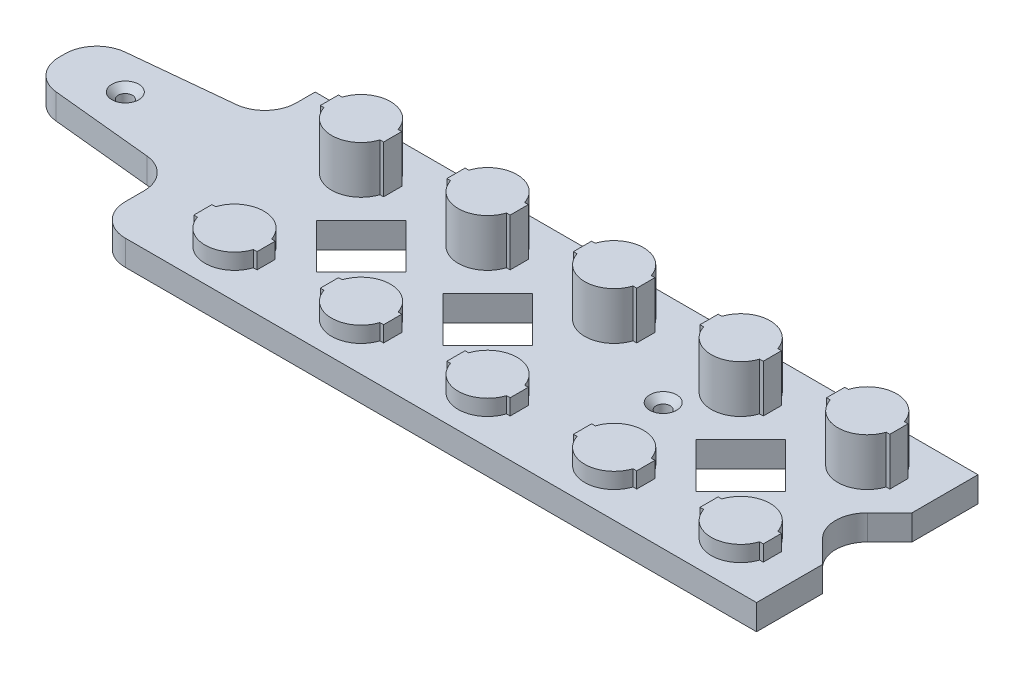
from build123d import *

# Parameters (mm, degrees)
SKETCH1_W           = 259.5
SKETCH1_H           = 70
SKETCH1_R           = 2.25
BOSS_EXTRUDE1_DEPTH = 8
BOSS_EXTRUDE2_DEPTH = 5
BOSS_EXTRUDE3_DEPTH = 15
CHAMFER2_SIZE       = 2
CUT_EXTRUDE2_DEPTH  = 194.184497308
FILLET1_R           = 10


with BuildPart() as part:
    # Sketch1 → Boss-Extrude1 (new body)
    with BuildSketch(Plane(origin=(0, 0, 0), x_dir=(1, 0, 0), z_dir=(0, 1, 0))):
        with Locations((24.75, 80)):
            Rectangle(SKETCH1_W, SKETCH1_H)
        with Locations(Location((-85, 85, 0), (0, 0, 270))):
            Circle(SKETCH1_R, mode=Mode.SUBTRACT)
        with Locations(Location((85, 85, 0), (0, 0, 270))):
            Circle(SKETCH1_R, mode=Mode.SUBTRACT)
    extrude(amount=BOSS_EXTRUDE1_DEPTH)

    # Sketch3 → Boss-Extrude2 (add)
    with BuildSketch(Plane(origin=(0, 8, 0), x_dir=(1, 0, 0), z_dir=(0, 1, 0))):
        with BuildLine():
            Line((-15.5, 57.125), (-15.5, 62.875))
            Line((-15.5, 62.875), (-16.655545523, 62.875))
            ThreePointArc((-16.655545523, 62.875), (-25.5, 69.3), (-34.344454477, 62.875))
            Line((-34.344454477, 62.875), (-35.5, 62.875))
            Line((-35.5, 62.875), (-35.5, 57.125))
            Line((-35.5, 57.125), (-34.344454477, 57.125))
            ThreePointArc((-34.344454477, 57.125), (-25.5, 50.7), (-16.655545523, 57.125))
            Line((-16.655545523, 57.125), (-15.5, 57.125))
        make_face()
        with BuildLine():
            Line((24.5, 57.125), (24.5, 62.875))
            Line((24.5, 62.875), (23.344454477, 62.875))
            ThreePointArc((23.344454477, 62.875), (14.5, 69.3), (5.655545523, 62.875))
            Line((5.655545523, 62.875), (4.5, 62.875))
            Line((4.5, 62.875), (4.5, 57.125))
            Line((4.5, 57.125), (5.655545523, 57.125))
            ThreePointArc((5.655545523, 57.125), (14.5, 50.7), (23.344454477, 57.125))
            Line((23.344454477, 57.125), (24.5, 57.125))
        make_face()
        with BuildLine():
            Line((64.5, 57.125), (64.5, 62.875))
            Line((64.5, 62.875), (63.344454477, 62.875))
            ThreePointArc((63.344454477, 62.875), (54.5, 69.3), (45.655545523, 62.875))
            Line((45.655545523, 62.875), (44.5, 62.875))
            Line((44.5, 62.875), (44.5, 57.125))
            Line((44.5, 57.125), (45.655545523, 57.125))
            ThreePointArc((45.655545523, 57.125), (54.5, 50.7), (63.344454477, 57.125))
            Line((63.344454477, 57.125), (64.5, 57.125))
        make_face()
        with BuildLine():
            Line((104.5, 57.125), (104.5, 62.875))
            Line((104.5, 62.875), (103.344454477, 62.875))
            ThreePointArc((103.344454477, 62.875), (94.5, 69.3), (85.655545523, 62.875))
            Line((85.655545523, 62.875), (84.5, 62.875))
            Line((84.5, 62.875), (84.5, 57.125))
            Line((84.5, 57.125), (85.655545523, 57.125))
            ThreePointArc((85.655545523, 57.125), (94.5, 50.7), (103.344454477, 57.125))
            Line((103.344454477, 57.125), (104.5, 57.125))
        make_face()
        with BuildLine():
            Line((144.5, 57.125), (144.5, 62.875))
            Line((144.5, 62.875), (143.344454477, 62.875))
            ThreePointArc((143.344454477, 62.875), (134.5, 69.3), (125.655545523, 62.875))
            Line((125.655545523, 62.875), (124.5, 62.875))
            Line((124.5, 62.875), (124.5, 57.125))
            Line((124.5, 57.125), (125.655545523, 57.125))
            ThreePointArc((125.655545523, 57.125), (134.5, 50.7), (143.344454477, 57.125))
            Line((143.344454477, 57.125), (144.5, 57.125))
        make_face()
    extrude(amount=BOSS_EXTRUDE2_DEPTH)

    # Sketch3<3> → Boss-Extrude3 (add)
    with BuildSketch(Plane(origin=(0, 8, 0), x_dir=(1, 0, 0), z_dir=(0, 1, 0))):
        with BuildLine():
            Line((24.5, 97.125), (24.5, 102.875))
            Line((24.5, 102.875), (23.344454477, 102.875))
            ThreePointArc((23.344454477, 102.875), (14.5, 109.3), (5.655545523, 102.875))
            Line((5.655545523, 102.875), (4.5, 102.875))
            Line((4.5, 102.875), (4.5, 97.125))
            Line((4.5, 97.125), (5.655545523, 97.125))
            ThreePointArc((5.655545523, 97.125), (14.5, 90.7), (23.344454477, 97.125))
            Line((23.344454477, 97.125), (24.5, 97.125))
        make_face()
        with BuildLine():
            Line((64.5, 97.125), (64.5, 102.875))
            Line((64.5, 102.875), (63.344454477, 102.875))
            ThreePointArc((63.344454477, 102.875), (54.5, 109.3), (45.655545523, 102.875))
            Line((45.655545523, 102.875), (44.5, 102.875))
            Line((44.5, 102.875), (44.5, 97.125))
            Line((44.5, 97.125), (45.655545523, 97.125))
            ThreePointArc((45.655545523, 97.125), (54.5, 90.7), (63.344454477, 97.125))
            Line((63.344454477, 97.125), (64.5, 97.125))
        make_face()
        with BuildLine():
            Line((104.5, 97.125), (104.5, 102.875))
            Line((104.5, 102.875), (103.344454477, 102.875))
            ThreePointArc((103.344454477, 102.875), (94.5, 109.3), (85.655545523, 102.875))
            Line((85.655545523, 102.875), (84.5, 102.875))
            Line((84.5, 102.875), (84.5, 97.125))
            Line((84.5, 97.125), (85.655545523, 97.125))
            ThreePointArc((85.655545523, 97.125), (94.5, 90.7), (103.344454477, 97.125))
            Line((103.344454477, 97.125), (104.5, 97.125))
        make_face()
        with BuildLine():
            Line((144.5, 97.125), (144.5, 102.875))
            Line((144.5, 102.875), (143.344454477, 102.875))
            ThreePointArc((143.344454477, 102.875), (134.5, 109.3), (125.655545523, 102.875))
            Line((125.655545523, 102.875), (124.5, 102.875))
            Line((124.5, 102.875), (124.5, 97.125))
            Line((124.5, 97.125), (125.655545523, 97.125))
            ThreePointArc((125.655545523, 97.125), (134.5, 90.7), (143.344454477, 97.125))
            Line((143.344454477, 97.125), (144.5, 97.125))
        make_face()
        with BuildLine():
            Line((-15.5, 97.125), (-15.5, 102.875))
            Line((-15.5, 102.875), (-16.655545523, 102.875))
            ThreePointArc((-16.655545523, 102.875), (-25.5, 109.3), (-34.344454477, 102.875))
            Line((-34.344454477, 102.875), (-35.5, 102.875))
            Line((-35.5, 102.875), (-35.5, 97.125))
            Line((-35.5, 97.125), (-34.344454477, 97.125))
            ThreePointArc((-34.344454477, 97.125), (-25.5, 90.7), (-16.655545523, 97.125))
            Line((-16.655545523, 97.125), (-15.5, 97.125))
        make_face()
    extrude(amount=BOSS_EXTRUDE3_DEPTH)

    # Chamfer2
    chamfer2_edges = [part.edges().sort_by_distance(p)[0] for p in [
        (-85, 8, -87.25),
        (85, 8, -87.25),
    ]]
    chamfer(chamfer2_edges, length=CHAMFER2_SIZE)

    # Sketch5 → Cut-Extrude2 (cut, through all)
    with BuildSketch(Plane(origin=(0, 8, 0), x_dir=(1, 0, 0), z_dir=(0, 1, 0))):
        Polygon((-55, 70), (-105, 75), (-105, 45), (-55, 45), align=None)
        Polygon((34.5, 65.857864376), (48.642135624, 80), (34.5, 94.142135624), (20.357864376, 80), align=None)
        Polygon((-105, 115), (-105, 95), (-55, 100), (-55, 115), align=None)
        Polygon((114.5, 65.857864376), (128.642135624, 80), (114.5, 94.142135624), (100.357864376, 80), align=None)
        Polygon((154.5, 65.857864376), (168.642135624, 80), (154.5, 94.142135624), (140.357864376, 80), align=None)
        Polygon((-5.5, 65.857864376), (8.642135624, 80), (-5.5, 94.142135624), (-19.642135624, 80), align=None)
    extrude(amount=-CUT_EXTRUDE2_DEPTH, mode=Mode.SUBTRACT)

    # Fillet1
    fillet1_edges = [part.edges().sort_by_distance(p)[0] for p in [
        (140.357864376, 4, -80),
        (-55, 4, -100),
        (-105, 4, -95),
        (-105, 4, -75),
        (-55, 4, -70),
        (-55, 4, -45),
    ]]
    fillet(fillet1_edges, radius=FILLET1_R)


solid = part.part
